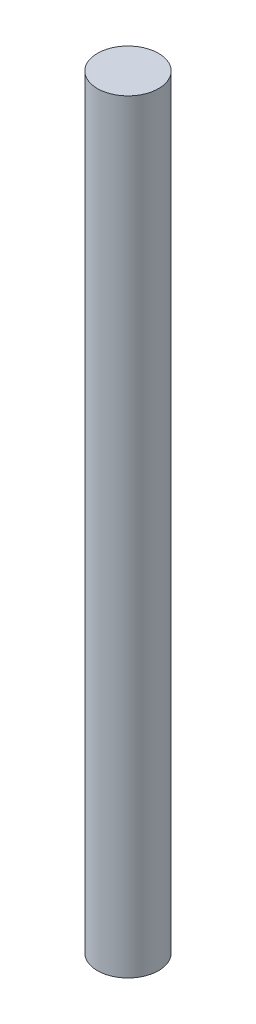
from build123d import *

# Parameters (mm, degrees)
SKETCH_1_R      = 4
EXTRUDE_1_DEPTH = 100


with BuildPart() as part:
    # 草图1 → 凸台-拉伸1 (new body)
    with BuildSketch(Plane(origin=(0, 0, 0), x_dir=(1, 0, 0), z_dir=(0, 1, 0))):
        with Locations(Location((0, 0, 0), (0, 0, 270))):
            Circle(SKETCH_1_R)
    extrude(amount=EXTRUDE_1_DEPTH)


solid = part.part
